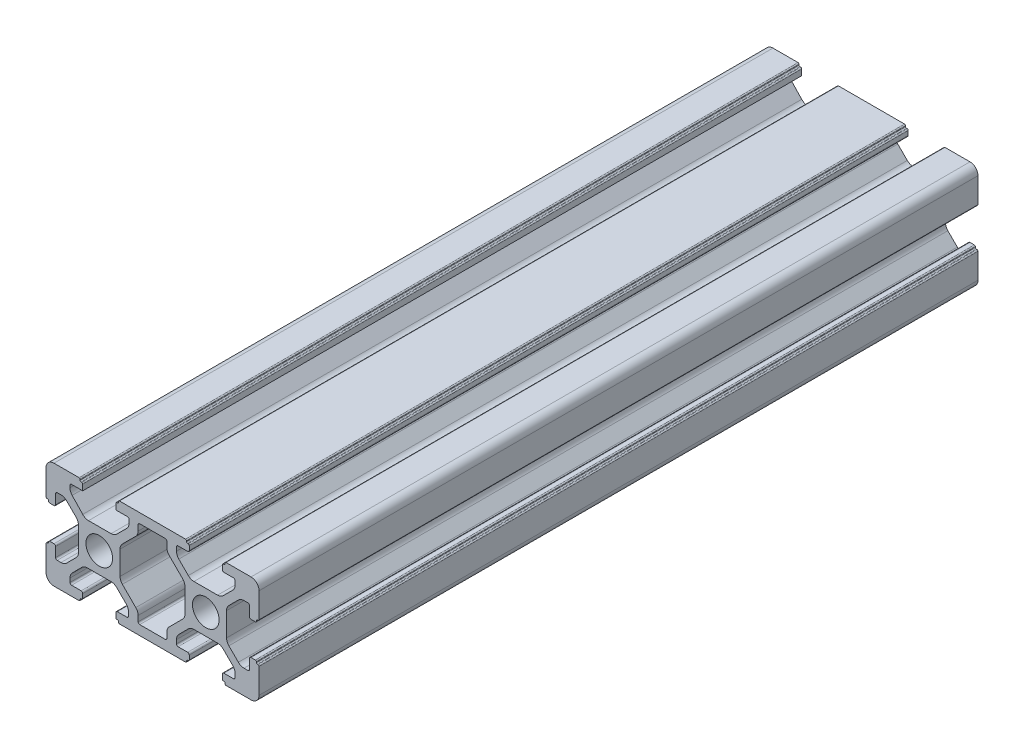
from build123d import *

# Parameters (mm, degrees)
SKETCH1_R           = 2.5
BOSS_EXTRUDE2_DEPTH = 135


with BuildPart() as part:
    # Sketch1 → Boss-Extrude2 (new body)
    with BuildSketch(Plane.XY):
        with BuildLine():
            Line((1.5, 0), (6.2, 0))
            ThreePointArc((6.2, 0), (6.341421356, 0.058578644), (6.4, 0.2))
            Line((6.4, 0.2), (6.4, 0.3))
            ThreePointArc((6.4, 0.3), (6.458578644, 0.441421356), (6.6, 0.5))
            Line((6.6, 0.5), (6.7, 0.5))
            ThreePointArc((6.7, 0.5), (6.841421356, 0.558578644), (6.9, 0.7))
            Line((6.9, 0.7), (6.9, 1.5))
            ThreePointArc((6.9, 1.5), (6.812132034, 1.712132034), (6.6, 1.8))
            Line((6.6, 1.8), (4.8, 1.8))
            ThreePointArc((4.8, 1.8), (4.587867966, 1.887867966), (4.5, 2.1))
            Line((4.5, 2.1), (4.5, 2.818019485))
            ThreePointArc((4.5, 2.818019485), (4.614180701, 3.392044633), (4.939339828, 3.878679656))
            Line((4.939339828, 3.878679656), (6.721320344, 5.660660172))
            ThreePointArc((6.721320344, 5.660660172), (7.207955367, 5.985819299), (7.781980515, 6.1))
            Line((7.781980515, 6.1), (12.218019485, 6.1))
            ThreePointArc((12.218019485, 6.1), (12.792044633, 5.985819299), (13.278679656, 5.660660172))
            Line((13.278679656, 5.660660172), (15.060660172, 3.878679656))
            ThreePointArc((15.060660172, 3.878679656), (15.385819299, 3.392044633), (15.5, 2.818019485))
            Line((15.5, 2.818019485), (15.5, 2.1))
            ThreePointArc((15.5, 2.1), (15.412132034, 1.887867966), (15.2, 1.8))
            Line((15.2, 1.8), (13.4, 1.8))
            ThreePointArc((13.4, 1.8), (13.187867966, 1.712132034), (13.1, 1.5))
            Line((13.1, 1.5), (13.1, 0.7))
            ThreePointArc((13.1, 0.7), (13.158578644, 0.558578644), (13.3, 0.5))
            Line((13.3, 0.5), (13.4, 0.5))
            ThreePointArc((13.4, 0.5), (13.541421356, 0.441421356), (13.6, 0.3))
            Line((13.6, 0.3), (13.6, 0.2))
            ThreePointArc((13.6, 0.2), (13.658578644, 0.058578644), (13.8, 0))
            Line((13.8, 0), (26.2, 0))
            ThreePointArc((26.2, 0), (26.341421356, 0.058578644), (26.4, 0.2))
            Line((26.4, 0.2), (26.4, 0.3))
            ThreePointArc((26.4, 0.3), (26.458578644, 0.441421356), (26.6, 0.5))
            Line((26.6, 0.5), (26.7, 0.5))
            ThreePointArc((26.7, 0.5), (26.841421356, 0.558578644), (26.9, 0.7))
            Line((26.9, 0.7), (26.9, 1.5))
            ThreePointArc((26.9, 1.5), (26.812132034, 1.712132034), (26.6, 1.8))
            Line((26.6, 1.8), (24.8, 1.8))
            ThreePointArc((24.8, 1.8), (24.587867966, 1.887867966), (24.5, 2.1))
            Line((24.5, 2.1), (24.5, 2.818019485))
            ThreePointArc((24.5, 2.818019485), (24.614180701, 3.392044633), (24.939339828, 3.878679656))
            Line((24.939339828, 3.878679656), (26.721320344, 5.660660172))
            ThreePointArc((26.721320344, 5.660660172), (27.207955367, 5.985819299), (27.781980515, 6.1))
            Line((27.781980515, 6.1), (32.218019485, 6.1))
            ThreePointArc((32.218019485, 6.1), (32.792044633, 5.985819299), (33.278679656, 5.660660172))
            Line((33.278679656, 5.660660172), (35.060660172, 3.878679656))
            ThreePointArc((35.060660172, 3.878679656), (35.385819299, 3.392044633), (35.5, 2.818019485))
            Line((35.5, 2.818019485), (35.5, 2.1))
            ThreePointArc((35.5, 2.1), (35.412132034, 1.887867966), (35.2, 1.8))
            Line((35.2, 1.8), (33.4, 1.8))
            ThreePointArc((33.4, 1.8), (33.187867966, 1.712132034), (33.1, 1.5))
            Line((33.1, 1.5), (33.1, 0.7))
            ThreePointArc((33.1, 0.7), (33.158578644, 0.558578644), (33.3, 0.5))
            Line((33.3, 0.5), (33.4, 0.5))
            ThreePointArc((33.4, 0.5), (33.541421356, 0.441421356), (33.6, 0.3))
            Line((33.6, 0.3), (33.6, 0.2))
            ThreePointArc((33.6, 0.2), (33.658578644, 0.058578644), (33.8, 0))
            Line((33.8, 0), (38.5, 0))
            ThreePointArc((38.5, 0), (39.560660172, 0.439339828), (40, 1.5))
            Line((40, 1.5), (40, 6.2))
            ThreePointArc((40, 6.2), (39.941421356, 6.341421356), (39.8, 6.4))
            Line((39.8, 6.4), (39.7, 6.4))
            ThreePointArc((39.7, 6.4), (39.558578644, 6.458578644), (39.5, 6.6))
            Line((39.5, 6.6), (39.5, 6.7))
            ThreePointArc((39.5, 6.7), (39.441421356, 6.841421356), (39.3, 6.9))
            Line((39.3, 6.9), (38.5, 6.9))
            ThreePointArc((38.5, 6.9), (38.287867966, 6.812132034), (38.2, 6.6))
            Line((38.2, 6.6), (38.2, 4.8))
            ThreePointArc((38.2, 4.8), (38.112132034, 4.587867966), (37.9, 4.5))
            Line((37.9, 4.5), (37.181980515, 4.5))
            ThreePointArc((37.181980515, 4.5), (36.607955367, 4.614180701), (36.121320344, 4.939339828))
            Line((36.121320344, 4.939339828), (34.339339828, 6.721320344))
            ThreePointArc((34.339339828, 6.721320344), (34.014180701, 7.207955367), (33.9, 7.781980515))
            Line((33.9, 7.781980515), (33.9, 12.218019485))
            ThreePointArc((33.9, 12.218019485), (34.014180701, 12.792044633), (34.339339828, 13.278679656))
            Line((34.339339828, 13.278679656), (36.121320344, 15.060660172))
            ThreePointArc((36.121320344, 15.060660172), (36.607955367, 15.385819299), (37.181980515, 15.5))
            Line((37.181980515, 15.5), (37.9, 15.5))
            ThreePointArc((37.9, 15.5), (38.112132034, 15.412132034), (38.2, 15.2))
            Line((38.2, 15.2), (38.2, 13.4))
            ThreePointArc((38.2, 13.4), (38.287867966, 13.187867966), (38.5, 13.1))
            Line((38.5, 13.1), (39.3, 13.1))
            ThreePointArc((39.3, 13.1), (39.441421356, 13.158578644), (39.5, 13.3))
            Line((39.5, 13.3), (39.5, 13.4))
            ThreePointArc((39.5, 13.4), (39.558578644, 13.541421356), (39.7, 13.6))
            Line((39.7, 13.6), (39.8, 13.6))
            ThreePointArc((39.8, 13.6), (39.941421356, 13.658578644), (40, 13.8))
            Line((40, 13.8), (40, 18.5))
            ThreePointArc((40, 18.5), (39.560660172, 19.560660172), (38.5, 20))
            Line((38.5, 20), (33.8, 20))
            ThreePointArc((33.8, 20), (33.658578644, 19.941421356), (33.6, 19.8))
            Line((33.6, 19.8), (33.6, 19.7))
            ThreePointArc((33.6, 19.7), (33.541421356, 19.558578644), (33.4, 19.5))
            Line((33.4, 19.5), (33.3, 19.5))
            ThreePointArc((33.3, 19.5), (33.158578644, 19.441421356), (33.1, 19.3))
            Line((33.1, 19.3), (33.1, 18.5))
            ThreePointArc((33.1, 18.5), (33.187867966, 18.287867966), (33.4, 18.2))
            Line((33.4, 18.2), (35.2, 18.2))
            ThreePointArc((35.2, 18.2), (35.412132034, 18.112132034), (35.5, 17.9))
            Line((35.5, 17.9), (35.5, 17.181980515))
            ThreePointArc((35.5, 17.181980515), (35.385819299, 16.607955367), (35.060660172, 16.121320344))
            Line((35.060660172, 16.121320344), (33.278679656, 14.339339828))
            ThreePointArc((33.278679656, 14.339339828), (32.792044633, 14.014180701), (32.218019485, 13.9))
            Line((32.218019485, 13.9), (27.781980515, 13.9))
            ThreePointArc((27.781980515, 13.9), (27.207955367, 14.014180701), (26.721320344, 14.339339828))
            Line((26.721320344, 14.339339828), (24.939339828, 16.121320344))
            ThreePointArc((24.939339828, 16.121320344), (24.614180701, 16.607955367), (24.5, 17.181980515))
            Line((24.5, 17.181980515), (24.5, 17.9))
            ThreePointArc((24.5, 17.9), (24.587867966, 18.112132034), (24.8, 18.2))
            Line((24.8, 18.2), (26.6, 18.2))
            ThreePointArc((26.6, 18.2), (26.812132034, 18.287867966), (26.9, 18.5))
            Line((26.9, 18.5), (26.9, 19.3))
            ThreePointArc((26.9, 19.3), (26.841421356, 19.441421356), (26.7, 19.5))
            Line((26.7, 19.5), (26.6, 19.5))
            ThreePointArc((26.6, 19.5), (26.458578644, 19.558578644), (26.4, 19.7))
            Line((26.4, 19.7), (26.4, 19.8))
            ThreePointArc((26.4, 19.8), (26.341421356, 19.941421356), (26.2, 20))
            Line((26.2, 20), (13.8, 20))
            ThreePointArc((13.8, 20), (13.658578644, 19.941421356), (13.6, 19.8))
            Line((13.6, 19.8), (13.6, 19.7))
            ThreePointArc((13.6, 19.7), (13.541421356, 19.558578644), (13.4, 19.5))
            Line((13.4, 19.5), (13.3, 19.5))
            ThreePointArc((13.3, 19.5), (13.158578644, 19.441421356), (13.1, 19.3))
            Line((13.1, 19.3), (13.1, 18.2))
            Line((13.1, 18.2), (15.3, 18.2))
            ThreePointArc((15.3, 18.2), (15.512132034, 18.112132034), (15.6, 17.9))
            Line((15.6, 17.9), (15.6, 17.281980515))
            ThreePointArc((15.6, 17.281980515), (15.485819299, 16.707955367), (15.160660172, 16.221320344))
            Line((15.160660172, 16.221320344), (13.278679656, 14.339339828))
            ThreePointArc((13.278679656, 14.339339828), (12.792044633, 14.014180701), (12.218019485, 13.9))
            Line((12.218019485, 13.9), (7.986375635, 13.9))
            ThreePointArc((7.986375635, 13.9), (7.393381044, 14.022191082), (6.896997987, 14.36885678))
            Line((6.896997987, 14.36885678), (4.910622352, 16.467414163))
            ThreePointArc((4.910622352, 16.467414163), (4.606431474, 16.943609851), (4.5, 17.498557383))
            Line((4.5, 17.498557383), (4.5, 17.9))
            ThreePointArc((4.5, 17.9), (4.587867966, 18.112132034), (4.8, 18.2))
            Line((4.8, 18.2), (6.9, 18.2))
            Line((6.9, 18.2), (6.9, 19.3))
            ThreePointArc((6.9, 19.3), (6.841421356, 19.441421356), (6.7, 19.5))
            Line((6.7, 19.5), (6.6, 19.5))
            ThreePointArc((6.6, 19.5), (6.458578644, 19.558578644), (6.4, 19.7))
            Line((6.4, 19.7), (6.4, 19.8))
            ThreePointArc((6.4, 19.8), (6.341421356, 19.941421356), (6.2, 20))
            Line((6.2, 20), (1.5, 20))
            ThreePointArc((1.5, 20), (0.439339828, 19.560660172), (0, 18.5))
            Line((0, 18.5), (0, 13.8))
            ThreePointArc((0, 13.8), (0.058578644, 13.658578644), (0.2, 13.6))
            Line((0.2, 13.6), (0.3, 13.6))
            ThreePointArc((0.3, 13.6), (0.441421356, 13.541421356), (0.5, 13.4))
            Line((0.5, 13.4), (0.5, 13.3))
            ThreePointArc((0.5, 13.3), (0.558578644, 13.158578644), (0.7, 13.1))
            Line((0.7, 13.1), (1.5, 13.1))
            ThreePointArc((1.5, 13.1), (1.712132034, 13.187867966), (1.8, 13.4))
            Line((1.8, 13.4), (1.8, 15.2))
            ThreePointArc((1.8, 15.2), (1.887867966, 15.412132034), (2.1, 15.5))
            Line((2.1, 15.5), (2.818019485, 15.5))
            ThreePointArc((2.818019485, 15.5), (3.392044633, 15.385819299), (3.878679656, 15.060660172))
            Line((3.878679656, 15.060660172), (5.660660172, 13.278679656))
            ThreePointArc((5.660660172, 13.278679656), (5.985819299, 12.792044633), (6.1, 12.218019485))
            Line((6.1, 12.218019485), (6.1, 7.781980515))
            ThreePointArc((6.1, 7.781980515), (5.985819299, 7.207955367), (5.660660172, 6.721320344))
            Line((5.660660172, 6.721320344), (3.878679656, 4.939339828))
            ThreePointArc((3.878679656, 4.939339828), (3.392044633, 4.614180701), (2.818019485, 4.5))
            Line((2.818019485, 4.5), (2.1, 4.5))
            ThreePointArc((2.1, 4.5), (1.887867966, 4.587867966), (1.8, 4.8))
            Line((1.8, 4.8), (1.8, 6.6))
            ThreePointArc((1.8, 6.6), (1.712132034, 6.812132034), (1.5, 6.9))
            Line((1.5, 6.9), (0.7, 6.9))
            ThreePointArc((0.7, 6.9), (0.558578644, 6.841421356), (0.5, 6.7))
            Line((0.5, 6.7), (0.5, 6.6))
            ThreePointArc((0.5, 6.6), (0.441421356, 6.458578644), (0.3, 6.4))
            Line((0.3, 6.4), (0.2, 6.4))
            ThreePointArc((0.2, 6.4), (0.058578644, 6.341421356), (0, 6.2))
            Line((0, 6.2), (0, 1.5))
            ThreePointArc((0, 1.5), (0.439339828, 0.439339828), (1.5, 0))
        make_face()
        with Locations((10, 10)):
            Circle(SKETCH1_R, mode=Mode.SUBTRACT)
        with Locations((30, 10)):
            Circle(SKETCH1_R, mode=Mode.SUBTRACT)
        with BuildLine():
            Line((17.6, 1.8), (22.4, 1.8))
            ThreePointArc((22.4, 1.8), (22.612132034, 1.887867966), (22.7, 2.1))
            Line((22.7, 2.1), (22.7, 3.139339828))
            ThreePointArc((22.7, 3.139339828), (22.814180701, 3.713364977), (23.139339828, 4.2))
            Line((23.139339828, 4.2), (25.660660172, 6.721320344))
            ThreePointArc((25.660660172, 6.721320344), (25.985819299, 7.207955367), (26.1, 7.781980515))
            Line((26.1, 7.781980515), (26.1, 12.218019485))
            ThreePointArc((26.1, 12.218019485), (25.985819299, 12.792044633), (25.660660172, 13.278679656))
            Line((25.660660172, 13.278679656), (23.139339828, 15.8))
            ThreePointArc((23.139339828, 15.8), (22.814180701, 16.286635023), (22.7, 16.860660172))
            Line((22.7, 16.860660172), (22.7, 17.9))
            ThreePointArc((22.7, 17.9), (22.612132034, 18.112132034), (22.4, 18.2))
            Line((22.4, 18.2), (17.6, 18.2))
            ThreePointArc((17.6, 18.2), (17.387867966, 18.112132034), (17.3, 17.9))
            Line((17.3, 17.9), (17.3, 16.860660172))
            ThreePointArc((17.3, 16.860660172), (17.185819299, 16.286635023), (16.860660172, 15.8))
            Line((16.860660172, 15.8), (14.339339828, 13.278679656))
            ThreePointArc((14.339339828, 13.278679656), (14.014180701, 12.792044633), (13.9, 12.218019485))
            Line((13.9, 12.218019485), (13.9, 7.781980515))
            ThreePointArc((13.9, 7.781980515), (14.014180701, 7.207955367), (14.339339828, 6.721320344))
            Line((14.339339828, 6.721320344), (16.860660172, 4.2))
            ThreePointArc((16.860660172, 4.2), (17.185819299, 3.713364977), (17.3, 3.139339828))
            Line((17.3, 3.139339828), (17.3, 2.1))
            ThreePointArc((17.3, 2.1), (17.387867966, 1.887867966), (17.6, 1.8))
        make_face(mode=Mode.SUBTRACT)
    extrude(amount=BOSS_EXTRUDE2_DEPTH)


solid = part.part
